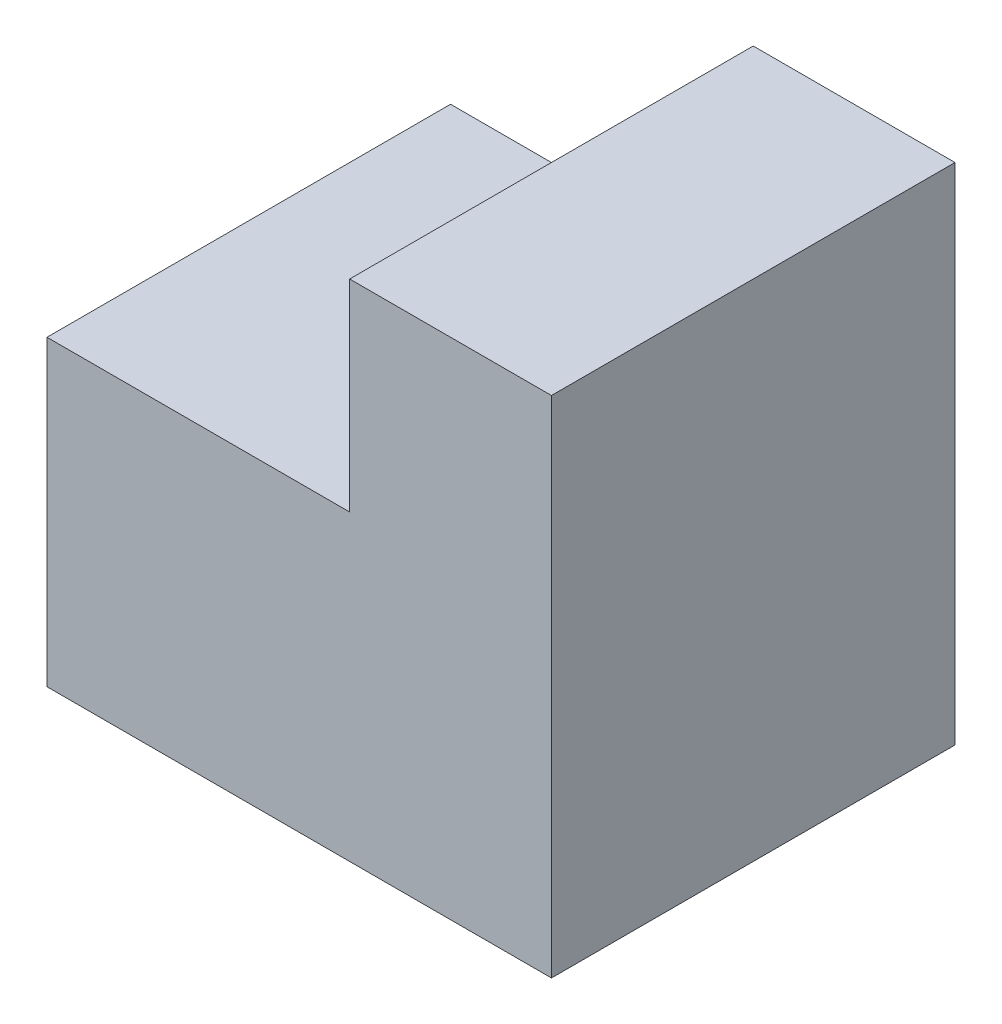
from build123d import *

# Parameters (mm, degrees)
BOSS_EXTRUDE1_DEPTH = 40


with BuildPart() as part:
    # Sketch1 → Boss-Extrude1 (new body)
    with BuildSketch(Plane.XY):
        Polygon((0, 0), (50, 0), (50, 50), (30, 50), (30, 30), (0, 30), align=None)
    extrude(amount=-BOSS_EXTRUDE1_DEPTH)


solid = part.part
